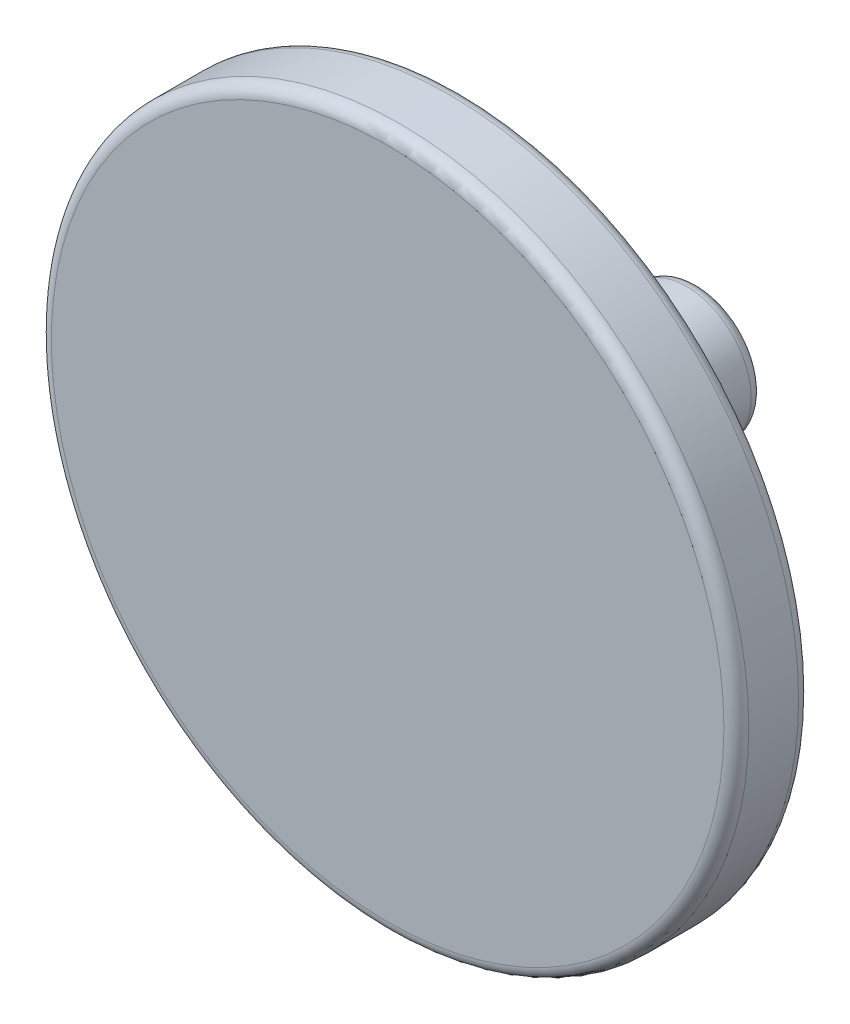
from build123d import *

# Parameters (mm, degrees)
BOSS_EXTRUDE1_DEPTH      = 2
BOSS_EXTRUDE1_DEPTH_BACK = 3
SKETCH1_R                = 3.25
SKETCH2_R                = 14
BOSS_EXTRUDE2_DEPTH      = 3
SKETCH3_R                = 2.6
BOSS_EXTRUDE3_DEPTH      = 4.5
FILLET1_R                = 0.5


with BuildPart() as part:
    # Sketch1 → Boss-Extrude1 (new, two sides: drawn at the far end of the back side and taken through both)
    with BuildSketch(Plane.XY.offset(-BOSS_EXTRUDE1_DEPTH_BACK)):
        with Locations((17.35, 0)):
            Circle(SKETCH1_R)
    extrude(amount=BOSS_EXTRUDE1_DEPTH + BOSS_EXTRUDE1_DEPTH_BACK)

    # Sketch2 → Boss-Extrude2 (add)
    with BuildSketch(Plane.XY.offset(2)):
        with Locations((17.35, 0)):
            Circle(SKETCH2_R)
    extrude(amount=BOSS_EXTRUDE2_DEPTH)

    # Sketch3 → Boss-Extrude3 (add)
    with BuildSketch(Plane(origin=(0, 0, -3), x_dir=(-1, 0, 0), z_dir=(0, 0, -1))):
        with Locations((-17.35, 0)):
            Circle(SKETCH3_R)
    extrude(amount=BOSS_EXTRUDE3_DEPTH)

    # Fillet1
    fillet1_edges = [part.edges().sort_by_distance(p)[0] for p in [
        (19.95, 0, -7.5),
        (14.1, 0, 2),
        (3.35, 0, 2),
        (3.35, 0, 5),
    ]]
    fillet(fillet1_edges, radius=FILLET1_R)


solid = part.part
